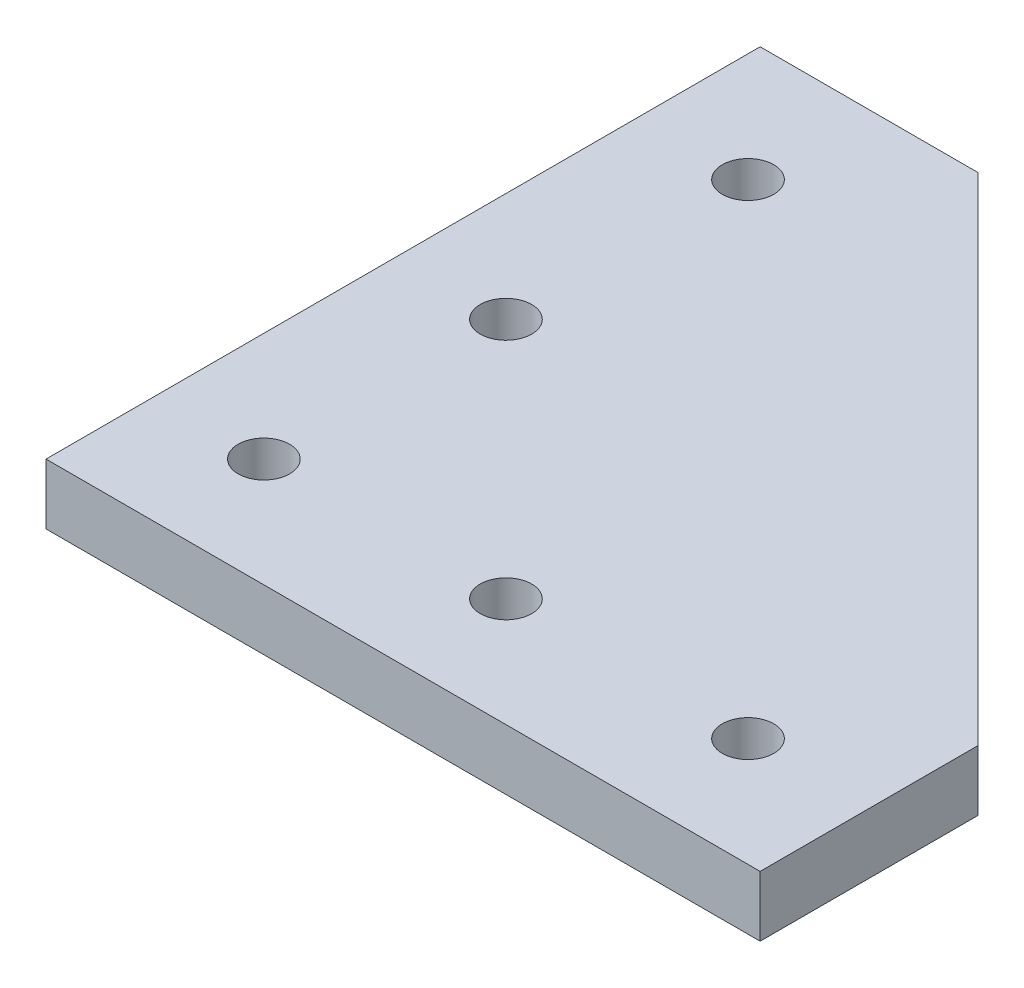
from build123d import *

# Parameters (mm, degrees)
SKETCH1_R           = 4.25
BOSS_EXTRUDE1_DEPTH = 10


with BuildPart() as part:
    # Sketch1 → Boss-Extrude1 (new body)
    with BuildSketch(Plane(origin=(0, 0, 0), x_dir=(1, 0, 0), z_dir=(0, 1, 0))):
        Polygon((-59, -59), (59, -59), (59, -23), (-23, 59), (-59, 59), align=None)
        with Locations(Location((-41, -41, 0), (0, 0, 270))):
            Circle(SKETCH1_R, mode=Mode.SUBTRACT)
        with Locations(Location((-1, -41, 0), (0, 0, 270))):
            Circle(SKETCH1_R, mode=Mode.SUBTRACT)
        with Locations(Location((39, -41, 0), (0, 0, 270))):
            Circle(SKETCH1_R, mode=Mode.SUBTRACT)
        with Locations(Location((-41, -1, 0), (0, 0, 270))):
            Circle(SKETCH1_R, mode=Mode.SUBTRACT)
        with Locations(Location((-41, 39, 0), (0, 0, 270))):
            Circle(SKETCH1_R, mode=Mode.SUBTRACT)
    extrude(amount=BOSS_EXTRUDE1_DEPTH)


solid = part.part
